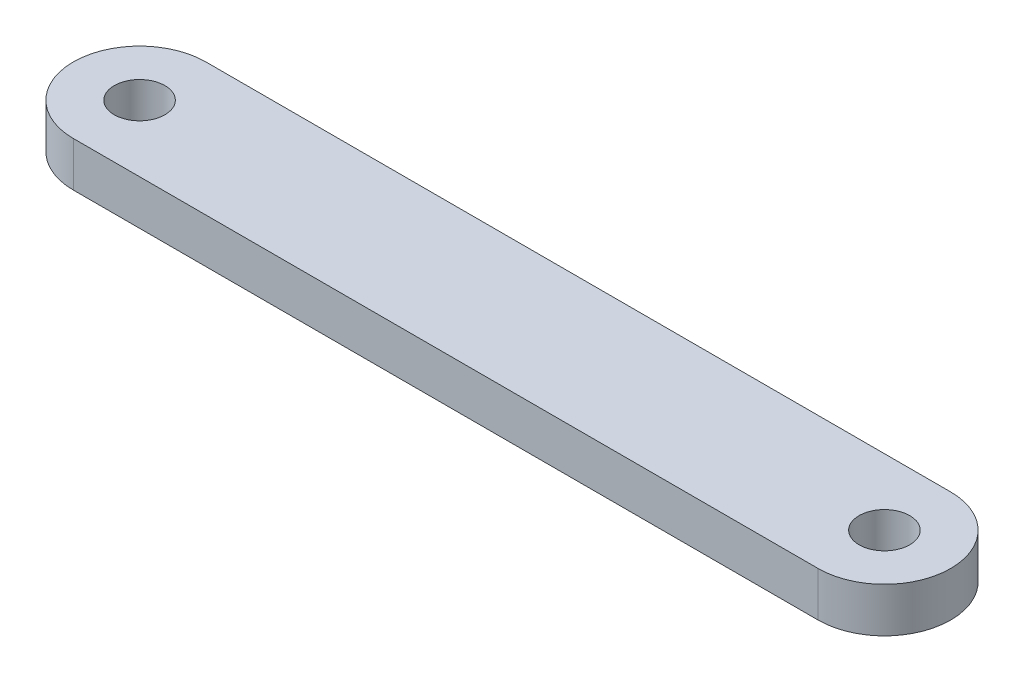
from build123d import *

# Parameters (mm, degrees)
SKETCH1_R           = 1.45
BOSS_EXTRUDE1_DEPTH = 3
SKETCH2_R           = 1.7
CUT_EXTRUDE1_DEPTH  = 55.713846511


with BuildPart() as part:
    # Sketch1 → Boss-Extrude1 (new body)
    with BuildSketch(Plane(origin=(0, 0, 0), x_dir=(1, 0, 0), z_dir=(0, 1, 0))):
        with BuildLine():
            ThreePointArc((0, 4.45), (-4.45, 0), (0, -4.45))
            Line((0, -4.45), (50, -4.45))
            ThreePointArc((50, -4.45), (54.45, 0), (50, 4.45))
            Line((50, 4.45), (0, 4.45))
        make_face()
        with Locations(Location((0, 0, 0), (0, 0, 270))):
            Circle(SKETCH1_R, mode=Mode.SUBTRACT)
        with Locations(Location((50, 0, 0), (0, 0, 270))):
            Circle(SKETCH1_R, mode=Mode.SUBTRACT)
    extrude(amount=BOSS_EXTRUDE1_DEPTH)

    # Sketch2 → Cut-Extrude1 (cut, through all)
    with BuildSketch(Plane(origin=(0, 3, 0), x_dir=(1, 0, 0), z_dir=(0, 1, 0))):
        with Locations(Location((0, 0, 0), (0, 0, 270))):
            Circle(SKETCH2_R)
        with Locations(Location((50, 0, 0), (0, 0, 270))):
            Circle(SKETCH2_R)
    extrude(amount=-CUT_EXTRUDE1_DEPTH, mode=Mode.SUBTRACT)


solid = part.part
